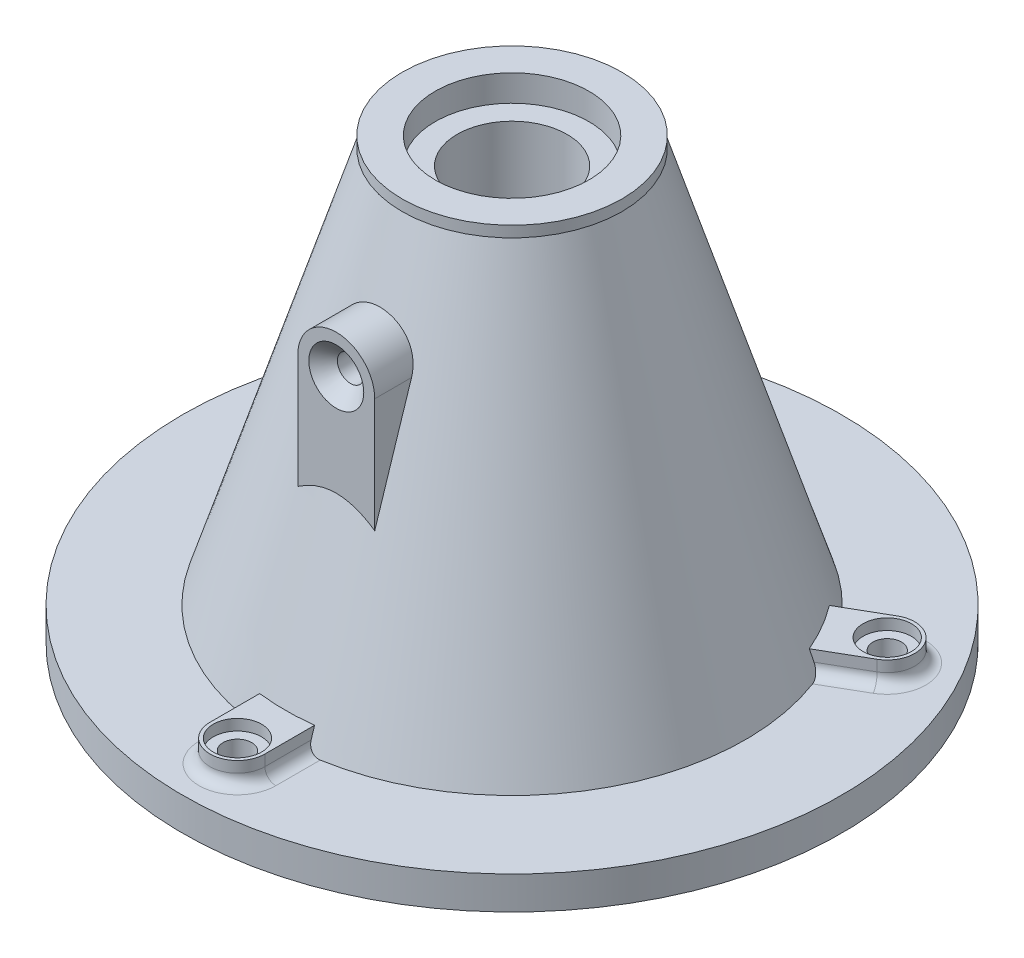
from build123d import *

# Parameters (mm, degrees)
BOSS_EXTRUDE1_DEPTH = 80
HOLE1_D             = 50
HOLE1_CBORE_D       = 70
HOLE1_CBORE_DEPTH   = 12
BOSS_EXTRUDE2_DEPTH = 10
CIRPATTERN1_COUNT   = 3
FILLET1_R           = 5
HOLE2_D             = 13
HOLE2_CBORE_D       = 22
HOLE2_CBORE_DEPTH   = 5


with BuildPart() as part:
    # Sketch1 → Revolve1 (revolve)
    with BuildSketch(Plane.XY):
        Polygon((-150, 0), (-150, 15), (-106.265538433, 15), (-50, 195), (-50, 200), (0, 200), (0, 0), align=None)
    revolve(axis=Axis((0, 200, 0), (0, -1, 0)))

    # Sketch2 → Boss-Extrude1 (add)
    with BuildSketch(Plane.XY):
        with BuildLine():
            Line((-17.5, 145), (-17.5, 90))
            Line((-17.5, 90), (17.5, 90))
            Line((17.5, 90), (17.5, 145))
            ThreePointArc((17.5, 145), (0, 162.5), (-17.5, 145))
        make_face()
    extrude(amount=BOSS_EXTRUDE1_DEPTH)

    # Sketch4 → Cut-Revolve1 (revolve, cut)
    with BuildSketch(Plane(origin=(0, 0, 0), x_dir=(0, 0, -1), z_dir=(1, 0, 0)), mode=Mode.PRIVATE) as cut_revolve1_sk:
        Polygon((0, 151), (-73.5, 151), (-80, 157.5), (-80, 145), (0, 145), align=None)
    revolve(cut_revolve1_sk.sketch.rotate(Axis((0, 145, 80), (0, 0, -1)), 90), axis=Axis((0, 145, 80), (0, 0, -1)), mode=Mode.SUBTRACT)

    # Hole1 (through all)
    with Locations(Plane(origin=(0, 200, 0), x_dir=(1, 0, 0), z_dir=(0, 1, 0))):
        with Locations((0, 0)):
            CounterBoreHole(HOLE1_D / 2, HOLE1_CBORE_D / 2, HOLE1_CBORE_DEPTH)

    # Sketch7 → Cut-Revolve2 (revolve, cut)
    with BuildSketch(Plane(origin=(0, 0, 0), x_dir=(0, 0, -1), z_dir=(1, 0, 0)), mode=Mode.PRIVATE) as cut_revolve2_sk:
        with BuildLine():
            Line((0, 0), (90, 0))
            Line((90, 0), (53.93166414, 115.38680044))
            ThreePointArc((53.93166414, 115.38680044), (46.296011996, 121), (38.660359853, 115.38680044))
            Line((38.660359853, 115.38680044), (26.973757314, 78))
            Line((26.973757314, 78), (0, 78))
            Line((0, 78), (0, 0))
        make_face()
    revolve(cut_revolve2_sk.sketch.rotate(Axis((0, 78, 0), (0, -1, 0)), 180), axis=Axis((0, 78, 0), (0, -1, 0)), mode=Mode.SUBTRACT)

    # Sketch10 → Boss-Extrude2 (add)
    with BuildSketch(Plane(origin=(0, 15, 0), x_dir=(1, 0, 0), z_dir=(0, 1, 0))):
        with BuildLine():
            Line((-12.5, -125), (-12.5, -100))
            Line((-12.5, -100), (12.5, -100))
            Line((12.5, -100), (12.5, -125))
            ThreePointArc((12.5, -125), (0, -137.5), (-12.5, -125))
        make_face()
    boss_extrude2 = extrude(amount=BOSS_EXTRUDE2_DEPTH)

    # CirPattern1: Boss-Extrude2 ×3 about axis
    cirpattern1_axis = Axis((0, 0, 0), (0, 1, 0))
    for i in range(1, CIRPATTERN1_COUNT):
        add(boss_extrude2.rotate(cirpattern1_axis, i * 360 / CIRPATTERN1_COUNT))

    # Fillet1
    fillet1_edges = [part.edges().sort_by_distance(p)[0] for p in [
        (93.571461612, 15, -68.45726528),
        (119.07849302, 15, -68.75),
        (12.5, 15, 115.263895465),
        (0, 15, 137.5),
        (-93.571461612, 15, -68.45726528),
        (-119.07849302, 15, -68.75),
        (106.071461612, 15, -46.806630185),
        (-12.5, 15, 115.263895465),
        (-106.071461612, 15, -46.806630185),
    ]]
    fillet(fillet1_edges, radius=FILLET1_R)

    # Hole2 (through all)
    with Locations(Plane(origin=(0, 25, 0), x_dir=(1, 0, 0), z_dir=(0, 1, 0))):
        with Locations((108.253175473, 62.5), (-108.253175473, 62.5), (0, -125)):
            CounterBoreHole(HOLE2_D / 2, HOLE2_CBORE_D / 2, HOLE2_CBORE_DEPTH)


solid = part.part
